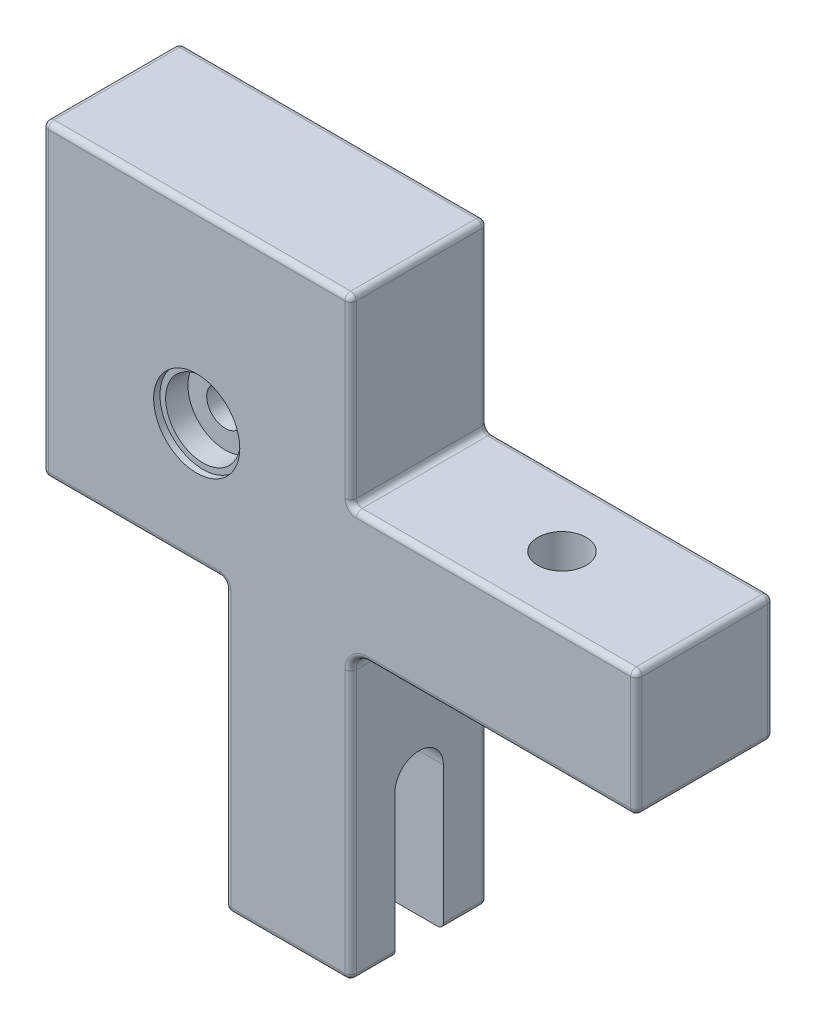
from build123d import *

# Parameters (mm, degrees)
BOSS_EXTRU_1_DEPTH       = 24
CONG_1_R                 = 3
ESQUISSE2_R              = 4.25
ENL_V_MAT_EXTRU_1_DEPTH  = 110.65086639
ESQUISSE3_R              = 4.25
ENL_V_MAT_EXTRU_2_DEPTH  = 94.22236856
ESQUISSE4_R              = 3.25
ENL_V_MAT_EXTRU_3_DEPTH  = 1.5
ESQUISSE4_2_R            = 3.25
ENL_V_MAT_EXTRU_4_DEPTH  = 99.696010558
CONG_2_R                 = 1
ESQUISSE7_R              = 3.25
BOSS_EXTRU_2_DEPTH       = 3
ESQUISSE8_R              = 7.55
ENL_V_MAT_EXTRU_7_DEPTH  = 1.1
ESQUISSE9_R              = 6.55
ENL_V_MAT_EXTRU_8_DEPTH  = 5
ENL_V_MAT_EXTRU_13_DEPTH = 94.22236856


with BuildPart() as part:
    # Esquisse1 → Boss.-Extru.1 (new body)
    with BuildSketch(Plane.XY):
        Polygon((-25.05, -50.1), (-25.05, 0), (25.05, 0), (25.05, 22), (-25.05, 22), (-25.05, 54), (-79.05, 54), (-79.05, 0), (-47.05, 0), (-47.05, -50.1), align=None)
    extrude(amount=-BOSS_EXTRU_1_DEPTH)

    # Congé1
    cong_1_edges = [part.edges().sort_by_distance(p)[0] for p in [
        (-25.05, 0, -12),
    ]]
    fillet(cong_1_edges, radius=CONG_1_R)

    # Esquisse2 → Enlèv. mat.-Extru.1 (cut, through all)
    with BuildSketch(Plane(origin=(0, 22, 0), x_dir=(1, 0, 0), z_dir=(0, 1, 0))):
        with Locations((0, 12)):
            Circle(ESQUISSE2_R)
    extrude(amount=-ENL_V_MAT_EXTRU_1_DEPTH, mode=Mode.SUBTRACT)

    # Esquisse3 → Enlèv. mat.-Extru.2 (cut, through all)
    with BuildSketch(Plane.ZY.offset(47.05)):
        with Locations((-12, -25.05)):
            Circle(ESQUISSE3_R)
    extrude(amount=-ENL_V_MAT_EXTRU_2_DEPTH, mode=Mode.SUBTRACT)

    # Esquisse4 → Enlèv. mat.-Extru.3 (cut)
    with BuildSketch(Plane.XY):
        with BuildLine():
            Line((-67.05, 47.6), (-67.05, 21.4))
            ThreePointArc((-67.05, 21.4), (-52.05, 6.4), (-37.05, 21.4))
            Line((-37.05, 21.4), (-37.05, 47.6))
            Line((-37.05, 47.6), (-67.05, 47.6))
        make_face()
        with Locations((-52.05, 21.4)):
            Circle(ESQUISSE4_R, mode=Mode.SUBTRACT)
    extrude(amount=-ENL_V_MAT_EXTRU_3_DEPTH, mode=Mode.SUBTRACT)

    # Esquisse4<2> → Enlèv. mat.-Extru.4 (cut, through all)
    with BuildSketch(Plane.XY):
        with Locations((-52.05, 21.4)):
            Circle(ESQUISSE4_2_R)
    extrude(amount=-ENL_V_MAT_EXTRU_4_DEPTH, mode=Mode.SUBTRACT)

    # Congé2
    cong_2_edges = [part.edges().sort_by_distance(p)[0] for p in [
        (-63.05, 0, -24),
        (-63.05, 0, 0),
        (0, 22, -24),
        (0, 22, 0),
        (-25.05, -26.55, 0),
        (-24.171320344, -0.878679656, 0),
        (-25.05, -26.55, -24),
        (-24.171320344, -0.878679656, -24),
        (-25.05, -50.1, -12),
        (-36.05, -50.1, -24),
        (-36.05, -50.1, 0),
        (-47.05, -50.1, -12),
        (-47.05, -25.05, -24),
        (-47.05, 0, -12),
        (-47.05, -25.05, 0),
        (25.05, 22, -12),
        (25.05, 11, -24),
        (25.05, 0, -12),
        (25.05, 11, 0),
        (-25.05, 38, -24),
        (-25.05, 22, -12),
        (-25.05, 38, 0),
        (-79.05, 0, -12),
        (-79.05, 27, -24),
        (-79.05, 27, 0),
        (-79.05, 54, -12),
        (-52.05, 54, -24),
        (-25.05, 54, -12),
        (-52.05, 54, 0),
        (1.5, 0, 0),
        (1.5, 0, -24),
    ]]
    fillet(cong_2_edges, radius=CONG_2_R)

    # Esquisse7 → Boss.-Extru.2 (add)
    with BuildSketch(Plane.XY):
        with BuildLine():
            Line((-37.05, 21.4), (-37.05, 47.6))
            Line((-37.05, 47.6), (-67.05, 47.6))
            Line((-67.05, 47.6), (-67.05, 21.4))
            ThreePointArc((-67.05, 21.4), (-52.05, 6.4), (-37.05, 21.4))
        make_face()
        with Locations((-52.05, 21.4)):
            Circle(ESQUISSE7_R, mode=Mode.SUBTRACT)
    extrude(amount=-BOSS_EXTRU_2_DEPTH)

    # Esquisse8 → Enlèv. mat.-Extru.7 (cut)
    with BuildSketch(Plane.XY):
        with Locations((-52.05, 21.4)):
            Circle(ESQUISSE8_R)
    extrude(amount=-ENL_V_MAT_EXTRU_7_DEPTH, mode=Mode.SUBTRACT)

    # Esquisse9 → Enlèv. mat.-Extru.8 (cut)
    with BuildSketch(Plane.XY):
        with Locations((-52.05, 21.4)):
            Circle(ESQUISSE9_R)
    extrude(amount=-ENL_V_MAT_EXTRU_8_DEPTH, mode=Mode.SUBTRACT)

    # Esquisse14 → Enlèv. mat.-Extru.13 (cut, through all)
    with BuildSketch(Plane.ZY.offset(47.05)):
        with BuildLine():
            Line((-16.25, -25.05), (-16.25, -50.1))
            Line((-16.25, -50.1), (-7.75, -50.1))
            Line((-7.75, -50.1), (-7.75, -25.05))
            ThreePointArc((-7.75, -25.05), (-12, -20.8), (-16.25, -25.05))
        make_face()
    extrude(amount=-ENL_V_MAT_EXTRU_13_DEPTH, mode=Mode.SUBTRACT)


solid = part.part
